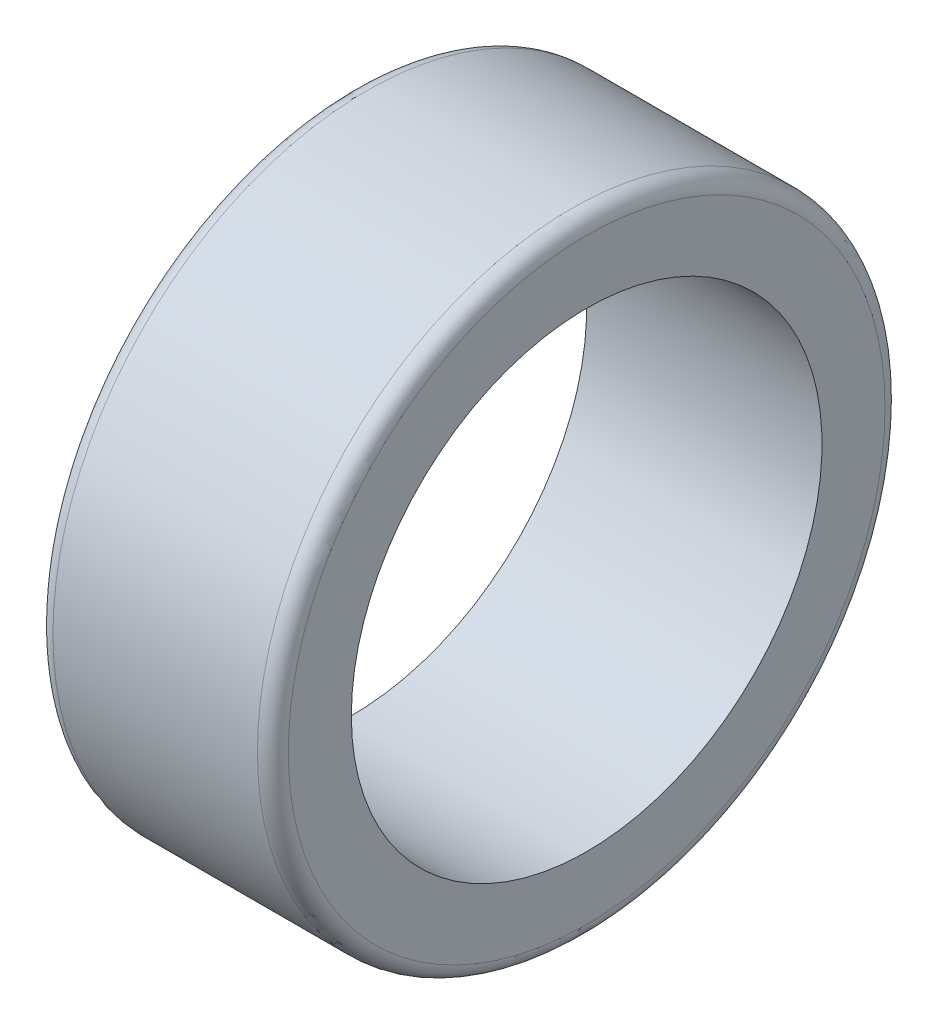
from build123d import *

# Parameters (mm, degrees)
SKETCH1_R           = 101.6
SKETCH1_R_2         = 76.2
BOSS_EXTRUDE1_DEPTH = 38.1
FILLET1_R           = 5


with BuildPart() as part:
    # Sketch1 → Boss-Extrude1 (new, symmetric)
    with BuildSketch(Plane(origin=(0, 0, 0), x_dir=(0, 0, -1), z_dir=(1, 0, 0))):
        with Locations(Location((0, 0, 0), (0, 0, 180))):
            Circle(SKETCH1_R)
        with Locations(Location((0, 0, 0), (0, 0, 180))):
            Circle(SKETCH1_R_2, mode=Mode.SUBTRACT)
    extrude(amount=BOSS_EXTRUDE1_DEPTH, both=True)

    # Fillet1
    fillet1_edges = [part.edges().sort_by_distance(p)[0] for p in [
        (-38.1, 0, -101.6),
        (38.1, 0, -101.6),
    ]]
    fillet(fillet1_edges, radius=FILLET1_R)


solid = part.part
